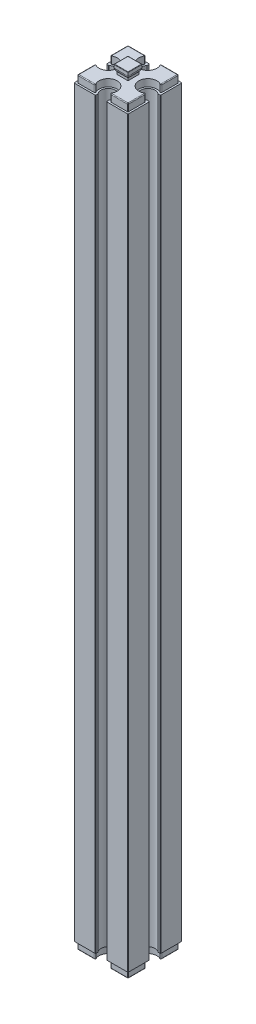
from build123d import *

# Parameters (mm, degrees)
EXTRUDE_1_DEPTH     = 103
EXTRUDE_2_DEPTH     = 2
EXTRUDE_3_DEPTH     = 2
CUT_EXTRUDE_1_DEPTH = 2.5
FILLET_1_R          = 0.1
FILLET_2_R          = 0.2
FILLET_3_R          = 0.2


with BuildPart() as part:
    # 草图1 → 凸台-拉伸1 (new body)
    with BuildSketch(Plane(origin=(0, 0, 0), x_dir=(1, 0, 0), z_dir=(0, 1, 0))):
        with BuildLine():
            Line((-7.5, 7.5), (-1.5, 7.5))
            Line((-1.5, 7.5), (-1.5, 6.822875656))
            ThreePointArc((-1.5, 6.822875656), (0, 3.5), (1.5, 6.822875656))
            Line((1.5, 6.822875656), (1.5, 7.5))
            Line((1.5, 7.5), (7.5, 7.5))
            Line((7.5, 7.5), (7.5, 1.5))
            Line((7.5, 1.5), (6.822875656, 1.5))
            ThreePointArc((6.822875656, 1.5), (3.5, 0), (6.822875656, -1.5))
            Line((6.822875656, -1.5), (7.5, -1.5))
            Line((7.5, -1.5), (7.5, -7.5))
            Line((7.5, -7.5), (1.5, -7.5))
            Line((1.5, -7.5), (1.5, -6.822875656))
            ThreePointArc((1.5, -6.822875656), (0, -3.5), (-1.5, -6.822875656))
            Line((-1.5, -6.822875656), (-1.5, -7.5))
            Line((-1.5, -7.5), (-7.5, -7.5))
            Line((-7.5, -7.5), (-7.5, -1.5))
            Line((-7.5, -1.5), (-6.822875656, -1.5))
            ThreePointArc((-6.822875656, -1.5), (-3.5, 0), (-6.822875656, 1.5))
            Line((-6.822875656, 1.5), (-7.5, 1.5))
            Line((-7.5, 1.5), (-7.5, 7.5))
        make_face()
    extrude_1 = extrude(amount=EXTRUDE_1_DEPTH)

    # 草图2 → 凸台-拉伸2 (add)
    with BuildSketch(Plane(origin=(0, 103, 0), x_dir=(1, 0, 0), z_dir=(0, 1, 0))):
        with BuildLine():
            Line((-7, 7), (-7, 2))
            ThreePointArc((-7, 2), (-3, 0), (-7, -2))
            Line((-7, -2), (-7, -7))
            Line((-7, -7), (-2, -7))
            ThreePointArc((-2, -7), (0, -3), (2, -7))
            Line((2, -7), (7, -7))
            Line((7, -7), (7, -2))
            ThreePointArc((7, -2), (3, 0), (7, 2))
            Line((7, 2), (7, 7))
            Line((7, 7), (2, 7))
            ThreePointArc((2, 7), (0, 3), (-2, 7))
            Line((-2, 7), (-7, 7))
        make_face()
    extrude_2 = extrude(amount=EXTRUDE_2_DEPTH)

    # 草图3 → 凸台-拉伸3 (add, symmetric)
    with BuildSketch(Plane(origin=(0, 0, 0), x_dir=(0, 0, -1), z_dir=(1, 0, 0))):
        with BuildLine():
            Line((-1.5, 105), (1.5, 105))
            Line((1.5, 105), (1.5, 105.677124344))
            ThreePointArc((1.5, 105.677124344), (1.780042303, 106.088161527), (1.95, 106.555590279))
            Line((1.95, 106.555590279), (1.95, 107.5))
            Line((1.95, 107.5), (-1.95, 107.5))
            Line((-1.95, 107.5), (-1.95, 106.555590279))
            ThreePointArc((-1.95, 106.555590279), (-1.780042303, 106.088161527), (-1.5, 105.677124344))
            Line((-1.5, 105.677124344), (-1.5, 105))
        make_face()
    extrude_3 = extrude(amount=EXTRUDE_3_DEPTH, both=True)

    # 草图4 → 切除-拉伸1 (cut, symmetric)
    with BuildSketch(Plane.XY):
        with BuildLine():
            Line((1.5, 105), (1.5, 105.677124344))
            ThreePointArc((1.5, 105.677124344), (1.780042303, 106.088161527), (1.95, 106.555590279))
            Line((1.95, 106.555590279), (1.95, 107.5))
            Line((1.95, 107.5), (2.5, 107.5))
            Line((2.5, 107.5), (2.5, 105))
            Line((2.5, 105), (1.5, 105))
        make_face()
        with BuildLine():
            Line((-1.5, 105), (-1.5, 105.677124344))
            ThreePointArc((-1.5, 105.677124344), (-1.780042303, 106.088161527), (-1.95, 106.555590279))
            Line((-1.95, 106.555590279), (-1.95, 107.5))
            Line((-1.95, 107.5), (-2.5, 107.5))
            Line((-2.5, 107.5), (-2.5, 105))
            Line((-2.5, 105), (-1.5, 105))
        make_face()
    cut_extrude_1 = extrude(amount=CUT_EXTRUDE_1_DEPTH, both=True, mode=Mode.SUBTRACT)

    # 镜向1: 凸台-拉伸1, 凸台-拉伸2, 凸台-拉伸3, 切除-拉伸1 across plane
    add(extrude_1.mirror(Plane.ZX))
    add(extrude_2.mirror(Plane.ZX))
    add(extrude_3.mirror(Plane.ZX))
    add(cut_extrude_1.mirror(Plane.ZX), mode=Mode.SUBTRACT)

    # 圆角1
    fillet_1_edges = [part.edges().sort_by_distance(p)[0] for p in [
        (0, 107.5, -1.95),
        (0, 107.5, 1.95),
        (-1.95, 107.5, 0),
        (1.95, 107.5, 0),
        (0, -107.5, 1.95),
        (0, -107.5, -1.95),
        (-1.95, -107.5, 0),
        (1.95, -107.5, 0),
    ]]
    fillet(fillet_1_edges, radius=FILLET_1_R)

    # 圆角2
    fillet_2_edges = [part.edges().sort_by_distance(p)[0] for p in [
        (-4.5, -105, -7),
        (-7, -104, -7),
        (-2, -104, -7),
        (4.5, -105, -7),
        (2, -104, -7),
        (7, -105, -4.5),
        (7, -104, -7),
        (7, -104, -2),
        (7, -105, 4.5),
        (7, -104, 2),
        (4.5, -105, 7),
        (7, -104, 7),
        (2, -104, 7),
        (-4.5, -105, 7),
        (-2, -104, 7),
        (-7, -105, 4.5),
        (-7, -104, 7),
        (-7, -104, 2),
        (-7, -105, -4.5),
        (-7, -104, -2),
        (-2, 104, -7),
        (-7, 104, -7),
        (-7, 104, -2),
        (-7, 104, 2),
        (-7, 104, 7),
        (-2, 104, 7),
        (2, 104, 7),
        (7, 104, 7),
        (7, 104, 2),
        (7, 104, -2),
        (7, 104, -7),
        (2, 104, -7),
        (-4.5, 105, -7),
        (-7, 105, -4.5),
        (-7, 105, 4.5),
        (-4.5, 105, 7),
        (4.5, 105, 7),
        (7, 105, 4.5),
        (7, 105, -4.5),
        (4.5, 105, -7),
    ]]
    fillet(fillet_2_edges, radius=FILLET_2_R)

    # 圆角3
    fillet_3_edges = [part.edges().sort_by_distance(p)[0] for p in [
        (-7.5, 0, -7.5),
        (-1.5, 0, -7.5),
        (1.5, 0, -7.5),
        (7.5, 0, -7.5),
        (7.5, 0, -1.5),
        (7.5, 0, 1.5),
        (7.5, 0, 7.5),
        (1.5, 0, 7.5),
        (-1.5, 0, 7.5),
        (-7.5, 0, 7.5),
        (-7.5, 0, 1.5),
        (-6.822875656, 0, -1.5),
        (-7.5, 0, -1.5),
    ]]
    fillet(fillet_3_edges, radius=FILLET_3_R)


solid = part.part
